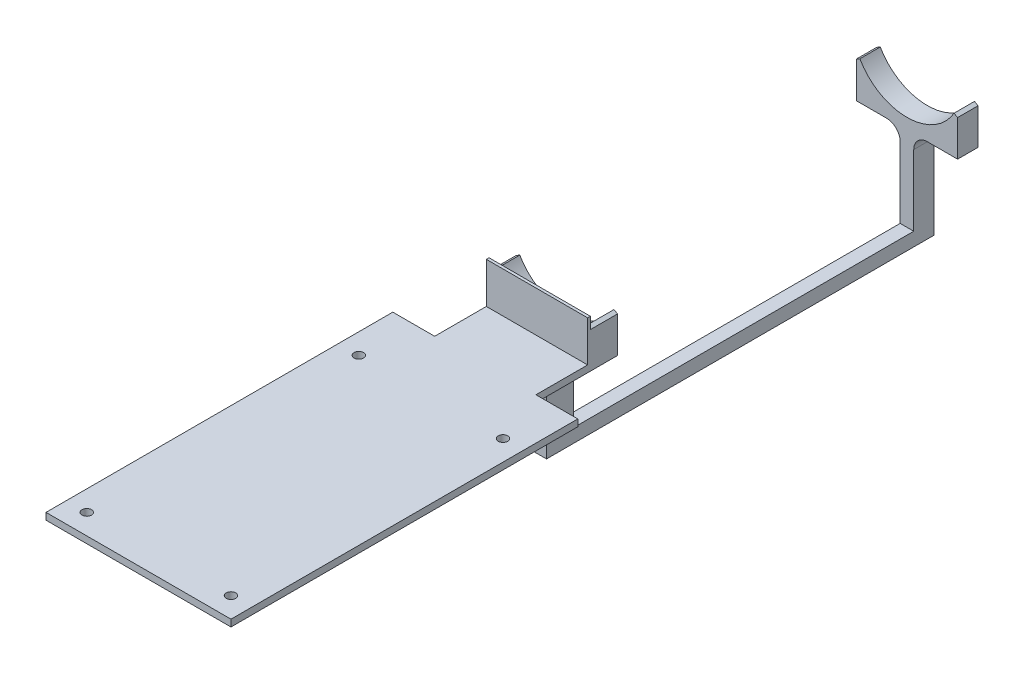
from build123d import *

# Parameters (mm, degrees)
EXTRUDE_START    = 130
EXTRUDE_1_DEPTH  = 10
EXTRUDE_START_2  = -130
EXTRUDE_2_DEPTH  = 15
SKETCH_2_R       = 3.5
EXTRUDE_5_DEPTH  = 5
EXTRUDE_START_3  = -20
EXTRUDE_11_DEPTH = 20
EXTRUDE_15_DEPTH = 15
EXTRUDE_16_DEPTH = 5
FILLET_1_R       = 10
SKETCH_9_W       = 74.478184726
SKETCH_9_H       = 2
EXTRUDE_17_DEPTH = 30


with BuildPart() as part:
    # 草图1 → 凸台-拉伸1 (new, symmetric)
    with BuildSketch(Plane.XY.offset(EXTRUDE_START)):
        with BuildLine():
            Line((-34.641016151, -20), (-37.239092363, -21.5))
            ThreePointArc((-37.239092363, -21.5), (0, -43), (37.239092363, -21.5))
            Line((37.239092363, -21.5), (34.641016151, -20))
            ThreePointArc((34.641016151, -20), (0, -40), (-34.641016151, -20))
        make_face()
    extrude(amount=EXTRUDE_1_DEPTH, both=True)



with BuildPart() as body_2:
    # 草图1<2> → 凸台-拉伸2 (new body)
    with BuildSketch(Plane.XY.offset(EXTRUDE_START_2)):
        with BuildLine():
            Line((-34.641016151, -20), (-37.239092363, -21.5))
            ThreePointArc((-37.239092363, -21.5), (0, -43), (37.239092363, -21.5))
            Line((37.239092363, -21.5), (34.641016151, -20))
            ThreePointArc((34.641016151, -20), (0, -40), (-34.641016151, -20))
        make_face()
    extrude(amount=-EXTRUDE_2_DEPTH)

    # 草图7 → 凸台-拉伸15 (add)
    with BuildSketch(Plane(origin=(0, 0, -145), x_dir=(-1, 0, 0), z_dir=(0, 0, -1))):
        with BuildLine():
            Line((37.239092363, -21.5), (37.239092363, -48))
            Line((37.239092363, -48), (-37.239092363, -48))
            Line((-37.239092363, -48), (-37.239092363, -21.5))
            ThreePointArc((-37.239092363, -21.5), (0, -43), (37.239092363, -21.5))
        make_face()
    extrude(amount=-EXTRUDE_15_DEPTH)


with BuildPart() as body_3:
    # 草图2 → 凸台-拉伸5 (new body)
    with BuildSketch(Plane(origin=(0, -43, 0), x_dir=(-1, 0, 0), z_dir=(0, -1, 0))):
        Polygon((-37.239092363, -180), (-68, -180), (-68, -434.984182396), (68, -434.984182396), (68, -180), (37.239092363, -180), (37.239092363, -120), (-37.239092363, -120), align=None)
        with Locations(Location((-53, -220, 0), (0, 0, 90))):
            Circle(SKETCH_2_R, mode=Mode.SUBTRACT)
        with Locations(Location((-53, -420, 0), (0, 0, 90))):
            Circle(SKETCH_2_R, mode=Mode.SUBTRACT)
        with Locations(Location((53, -420, 0), (0, 0, 270))):
            Circle(SKETCH_2_R, mode=Mode.SUBTRACT)
        with Locations(Location((53, -220, 0), (0, 0, 270))):
            Circle(SKETCH_2_R, mode=Mode.SUBTRACT)
    extrude(amount=EXTRUDE_5_DEPTH)


with BuildPart() as part_1:
    add(part.part)

    add(body_3.part)  # 凸台-拉伸11 merges body 3
    # 草图5 → 凸台-拉伸11 (add)
    with BuildSketch(Plane(origin=(0, 0, 120), x_dir=(-1, 0, 0), z_dir=(0, 0, -1)).offset(EXTRUDE_START_3)):
        with BuildLine():
            Line((-37.239092363, -21.5), (-37.239092363, -48))
            Line((-37.239092363, -48), (37.239092363, -48))
            Line((37.239092363, -48), (37.239092363, -21.5))
            ThreePointArc((37.239092363, -21.5), (0, -43), (-37.239092363, -21.5))
        make_face()
    extrude(amount=EXTRUDE_11_DEPTH)


    add(body_2.part)  # 凸台-拉伸16 merges body 2
    # 草图8 → 凸台-拉伸16 (add, symmetric)
    with BuildSketch(Plane(origin=(0, 0, 0), x_dir=(0, 0, -1), z_dir=(1, 0, 0))):
        Polygon((-140, -43), (-140, -120), (145, -120), (145, -43), (130, -43), (130, -48), (130, -110), (-120, -110), (-120, -48), (-120, -43), align=None)
    extrude(amount=EXTRUDE_16_DEPTH, both=True)

    # 圆角1
    fillet_1_edges = [part_1.edges().sort_by_distance(p)[0] for p in [
        (-5, -48, 130),
        (5, -48, 130),
        (-5, -48, -137.5),
        (5, -48, -137.5),
    ]]
    fillet(fillet_1_edges, radius=FILLET_1_R)

    # 草图9 → 凸台-拉伸17 (add)
    with BuildSketch(Plane(origin=(0, -43, 0), x_dir=(1, 0, 0), z_dir=(0, 1, 0))):
        with Locations((0, -141)):
            Rectangle(SKETCH_9_W, SKETCH_9_H)
    extrude(amount=EXTRUDE_17_DEPTH)


solid = part_1.part
